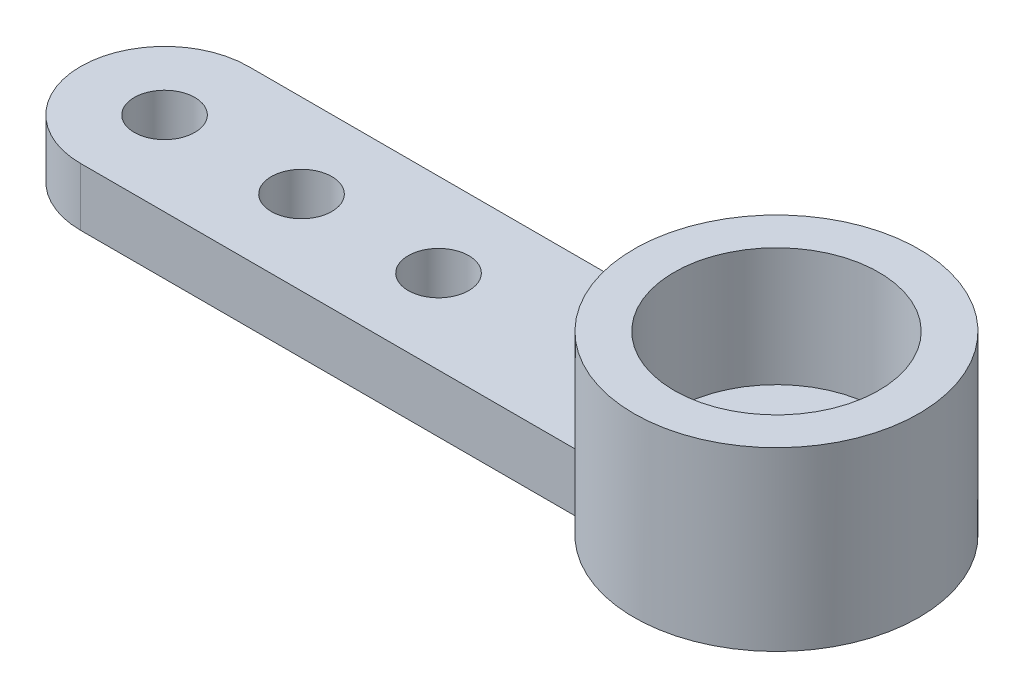
from build123d import *

# Parameters (mm, degrees)
BOSS_EXTRUDE1_DEPTH = 1.1
SKETCH2_R           = 2.7051
SKETCH2_R_2         = 1.9431
BOSS_EXTRUDE2_DEPTH = 2.25
SKETCH3_R           = 0.930000045
CUT_EXTRUDE1_DEPTH  = 14.668625754
CUT_EXTRUDE2_REACH  = 15.669
SKETCH4_R           = 0.575


with BuildPart() as part:
    # Sketch1 → Boss-Extrude1 (new body)
    with BuildSketch(Plane(origin=(0, 0, 0), x_dir=(1, 0, 0), z_dir=(0, 1, 0))):
        with BuildLine():
            Line((-2.185682545, 1.59385), (-11.61415, 1.59385))
            ThreePointArc((-11.61415, 1.59385), (-13.208, 0), (-11.61415, -1.59385))
            Line((-11.61415, -1.59385), (-2.185682545, -1.59385))
            ThreePointArc((-2.185682545, -1.59385), (2.7051, 0), (-2.185682545, 1.59385))
        make_face()
    extrude(amount=BOSS_EXTRUDE1_DEPTH)

    # Sketch2 → Boss-Extrude2 (add)
    with BuildSketch(Plane(origin=(0, 1.1, 0), x_dir=(1, 0, 0), z_dir=(0, 1, 0))):
        Circle(SKETCH2_R)
        Circle(SKETCH2_R_2, mode=Mode.SUBTRACT)
    extrude(amount=BOSS_EXTRUDE2_DEPTH)

    # Sketch3 → Cut-Extrude1 (cut, through all)
    with BuildSketch(Plane(origin=(0, 1.1, 0), x_dir=(1, 0, 0), z_dir=(0, 1, 0))):
        Circle(SKETCH3_R)
    extrude(amount=-CUT_EXTRUDE1_DEPTH, mode=Mode.SUBTRACT)

    # Sketch4 → Cut-Extrude2 (cut, up to next)
    with BuildSketch(Plane(origin=(0, 1.1, 0), x_dir=(1, 0, 0), z_dir=(0, 1, 0)), mode=Mode.PRIVATE) as cut_extrude2_sk1:
        with Locations((-11.61415, 0)):
            Circle(SKETCH4_R)
    cut_extrude2_tool1 = extrude(cut_extrude2_sk1.sketch, amount=-CUT_EXTRUDE2_REACH, mode=Mode.PRIVATE) & part.part
    # Sketch4 → Cut-Extrude2 (cut, up to next)
    with BuildSketch(Plane(origin=(0, 1.1, 0), x_dir=(1, 0, 0), z_dir=(0, 1, 0)), mode=Mode.PRIVATE) as cut_extrude2_sk2:
        with Locations((-9.01415, 0)):
            Circle(SKETCH4_R)
    cut_extrude2_tool2 = extrude(cut_extrude2_sk2.sketch, amount=-CUT_EXTRUDE2_REACH, mode=Mode.PRIVATE) & part.part
    # Sketch4 → Cut-Extrude2 (cut, up to next)
    with BuildSketch(Plane(origin=(0, 1.1, 0), x_dir=(1, 0, 0), z_dir=(0, 1, 0)), mode=Mode.PRIVATE) as cut_extrude2_sk3:
        with Locations((-6.41415, 0)):
            Circle(SKETCH4_R)
    cut_extrude2_tool3 = extrude(cut_extrude2_sk3.sketch, amount=-CUT_EXTRUDE2_REACH, mode=Mode.PRIVATE) & part.part
    add(cut_extrude2_tool1.solids().sort_by_distance((-11.61415, 1.1, 0))[0], mode=Mode.SUBTRACT)
    add(cut_extrude2_tool2.solids().sort_by_distance((-9.01415, 1.1, 0))[0], mode=Mode.SUBTRACT)
    add(cut_extrude2_tool3.solids().sort_by_distance((-6.41415, 1.1, 0))[0], mode=Mode.SUBTRACT)


solid = part.part
